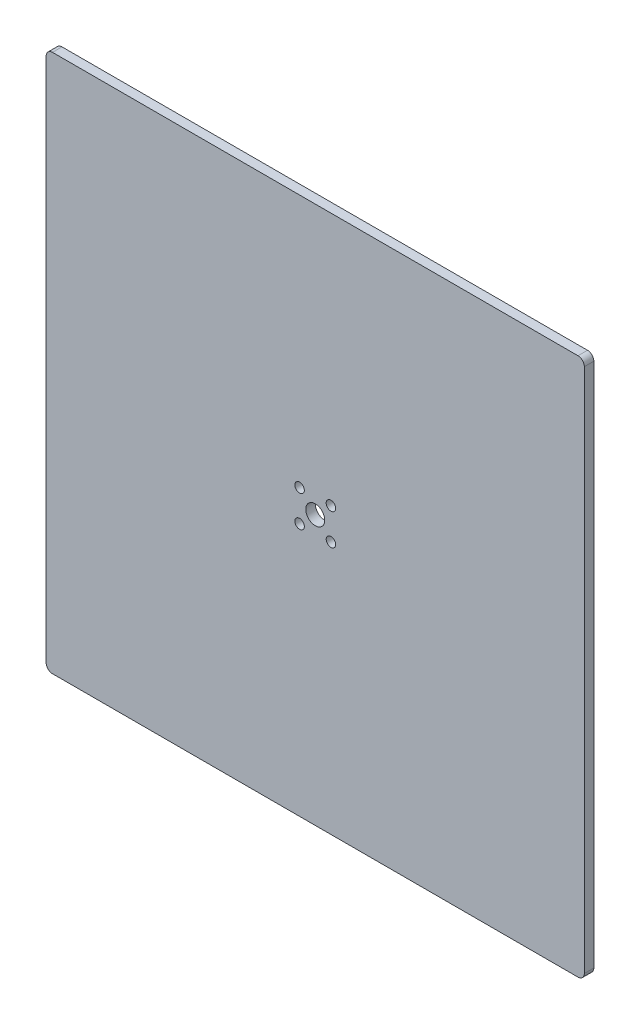
from build123d import *

# Parameters (mm, degrees)
SKETCH_1_W          = 170
SKETCH_1_H          = 170
EXTRUDE_1_DEPTH     = 3
SKETCH_3_R          = 3
SKETCH_3_R_2        = 1.5
CUT_EXTRUDE_1_DEPTH = 121.245582039
FILLET_1_R          = 2


with BuildPart() as part:
    # 草图1 → 凸台-拉伸1 (new body)
    with BuildSketch(Plane.XY):
        Rectangle(SKETCH_1_W, SKETCH_1_H)
    extrude(amount=EXTRUDE_1_DEPTH)

    # 草图3 → 切除-拉伸1 (cut, through all)
    with BuildSketch(Plane(origin=(0, 0, 0), x_dir=(-1, 0, 0), z_dir=(0, 0, -1))):
        Circle(SKETCH_3_R)
        with Locations((4.95, 4.95)):
            Circle(SKETCH_3_R_2)
        with Locations((-4.95, 4.95)):
            Circle(SKETCH_3_R_2)
        with Locations((-4.95, -4.95)):
            Circle(SKETCH_3_R_2)
        with Locations((4.95, -4.95)):
            Circle(SKETCH_3_R_2)
    extrude(amount=-CUT_EXTRUDE_1_DEPTH, mode=Mode.SUBTRACT)

    # 圆角1
    fillet_1_edges = [part.edges().sort_by_distance(p)[0] for p in [
        (-85, 85, 1.5),
        (85, 85, 1.5),
        (85, -85, 1.5),
        (-85, -85, 1.5),
    ]]
    fillet(fillet_1_edges, radius=FILLET_1_R)


solid = part.part
